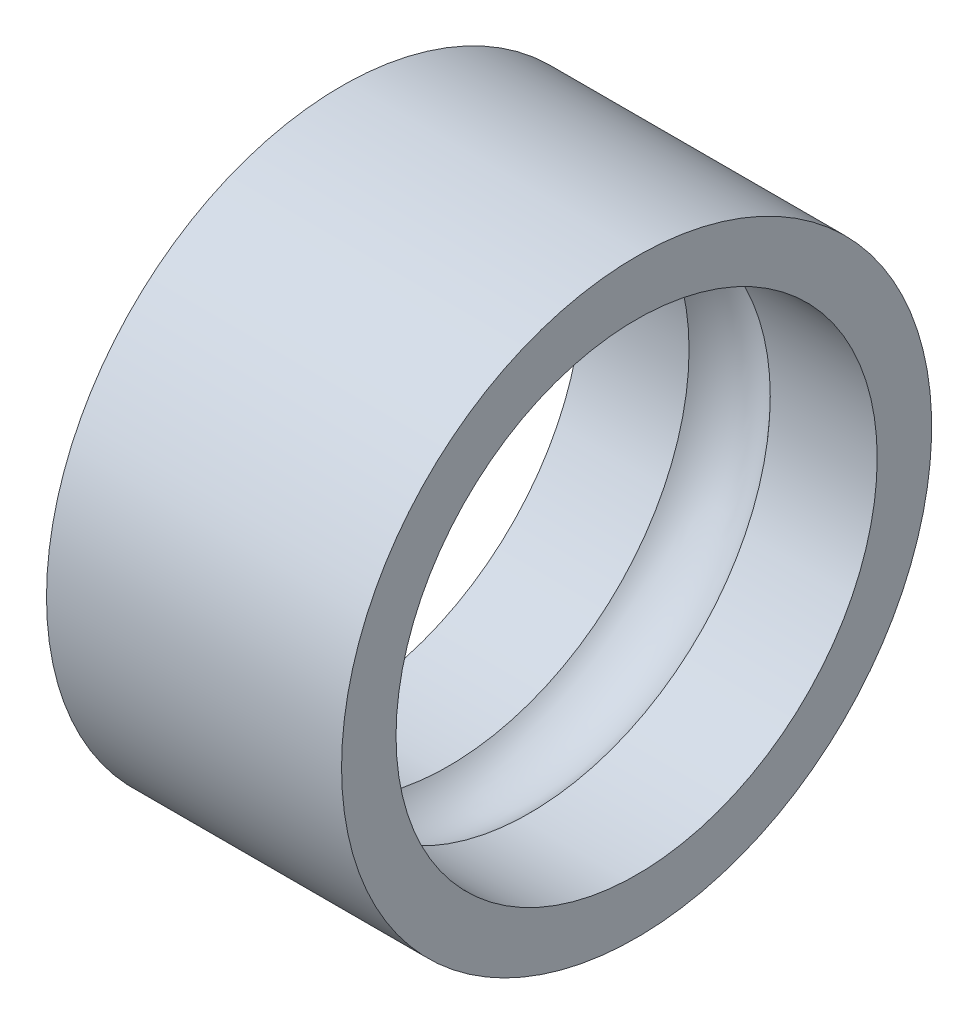
from build123d import *


with BuildPart() as part:
    # Sketch1 → Revolve1 (revolve)
    with BuildSketch(Plane.XY, mode=Mode.PRIVATE) as revolve1_sk:
        with BuildLine():
            Line((2.752083666, 16.30769231), (10, 16.30769231))
            Line((10, 16.30769231), (10, 20))
            Line((10, 20), (-10, 20))
            Line((-10, 20), (-10, 16.30769231))
            Line((-10, 16.30769231), (-2.752083666, 16.30769231))
            ThreePointArc((-2.752083666, 16.30769231), (0, 17.538461543), (2.752083666, 16.30769231))
        make_face()
    revolve(revolve1_sk.sketch.rotate(Axis((0, 0, 0), (1, 0, 0)), 90), axis=Axis((0, 0, 0), (1, 0, 0)))


solid = part.part
